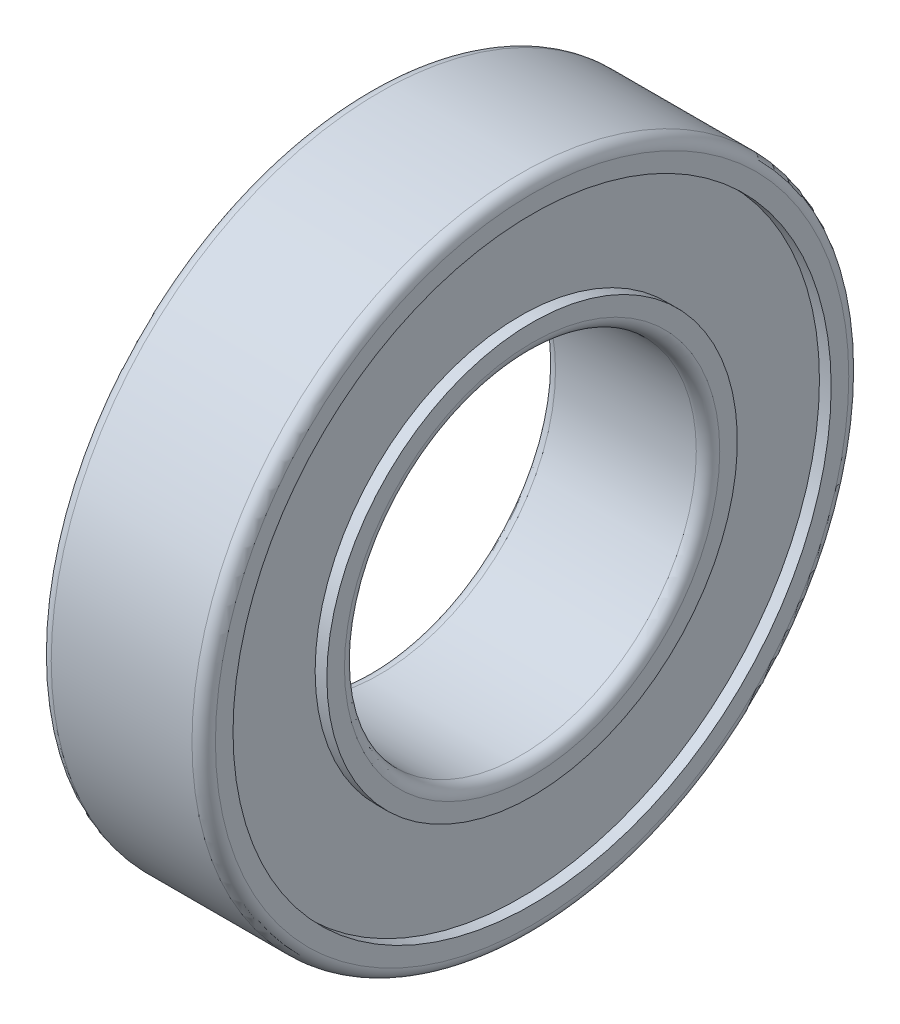
from build123d import *


with BuildPart() as part:
    # Sketch1 → Revolve1 (revolve)
    with BuildSketch(Plane(origin=(0, 0, 0), x_dir=(-1, 0, 0), z_dir=(0, 0, -1)), mode=Mode.PRIVATE) as revolve1_sk:
        with BuildLine():
            Line((0, 8.75), (-0.5, 8.75))
            Line((-0.5, 8.75), (-0.5, 12.75))
            Line((-0.5, 12.75), (0, 12.75))
            Line((0, 12.75), (0, 13.5))
            ThreePointArc((0, 13.5), (-0.146446609, 13.853553391), (-0.5, 14))
            Line((-0.5, 14), (-6.5, 14))
            ThreePointArc((-6.5, 14), (-6.853553391, 13.853553391), (-7, 13.5))
            Line((-7, 13.5), (-7, 12.75))
            Line((-7, 12.75), (-6.5, 12.75))
            Line((-6.5, 12.75), (-6.5, 8.75))
            Line((-6.5, 8.75), (-7, 8.75))
            Line((-7, 8.75), (-7, 8))
            ThreePointArc((-7, 8), (-6.853553391, 7.646446609), (-6.5, 7.5))
            Line((-6.5, 7.5), (-0.5, 7.5))
            ThreePointArc((-0.5, 7.5), (-0.146446609, 7.646446609), (0, 8))
            Line((0, 8), (0, 8.75))
        make_face()
    revolve(revolve1_sk.sketch.rotate(Axis((7.001250002, 0, 0), (-1, 0, 0)), 270), axis=Axis((7.001250002, 0, 0), (-1, 0, 0)))


solid = part.part
